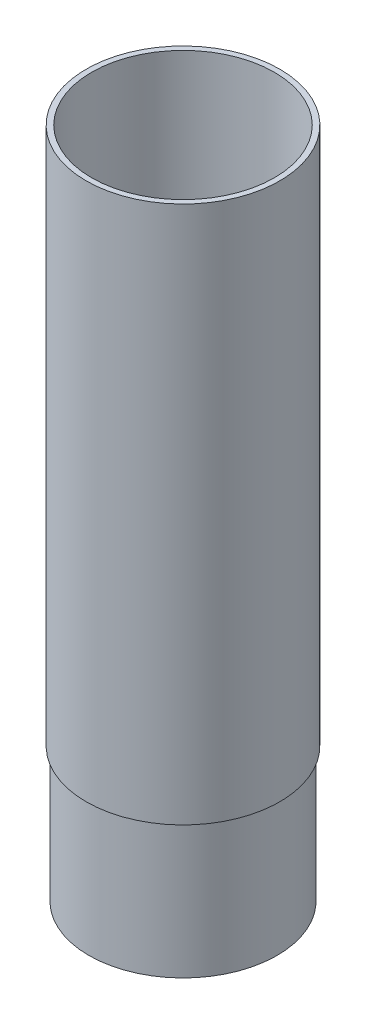
from build123d import *

# Parameters (mm, degrees)
ESQUISSE1_R             = 35
BOSS_EXTRU_2_DEPTH      = 250
ESQUISSE4_R             = 34
ENL_V_MAT_EXTRU_3_DEPTH = 250
ESQUISSE5_R             = 36
BOSS_EXTRU_5_DEPTH      = 200
ESQUISSE6_R             = 34
ENL_V_MAT_EXTRU_4_DEPTH = 200


with BuildPart() as part:
    # Esquisse1 → Boss.-Extru.2 (new body)
    with BuildSketch(Plane(origin=(0, 0, 0), x_dir=(1, 0, 0), z_dir=(0, 1, 0))):
        with Locations(Location((0, 0, 0), (0, 0, 270))):
            Circle(ESQUISSE1_R)
    extrude(amount=BOSS_EXTRU_2_DEPTH)

    # Esquisse4 → Enlèv. mat.-Extru.3 (cut)
    with BuildSketch(Plane(origin=(0, 250, 0), x_dir=(1, 0, 0), z_dir=(0, 1, 0))):
        with Locations(Location((0, 0, 0), (0, 0, 270))):
            Circle(ESQUISSE4_R)
    extrude(amount=-ENL_V_MAT_EXTRU_3_DEPTH, mode=Mode.SUBTRACT)

    # Esquisse5 → Boss.-Extru.5 (add)
    with BuildSketch(Plane(origin=(0, 250, 0), x_dir=(1, 0, 0), z_dir=(0, 1, 0))):
        with Locations(Location((0, 0, 0), (0, 0, 270))):
            Circle(ESQUISSE5_R)
    extrude(amount=-BOSS_EXTRU_5_DEPTH)

    # Esquisse6 → Enlèv. mat.-Extru.4 (cut)
    with BuildSketch(Plane(origin=(0, 250, 0), x_dir=(1, 0, 0), z_dir=(0, 1, 0))):
        with Locations(Location((0, 0, 0), (0, 0, 270))):
            Circle(ESQUISSE6_R)
    extrude(amount=-ENL_V_MAT_EXTRU_4_DEPTH, mode=Mode.SUBTRACT)


solid = part.part
